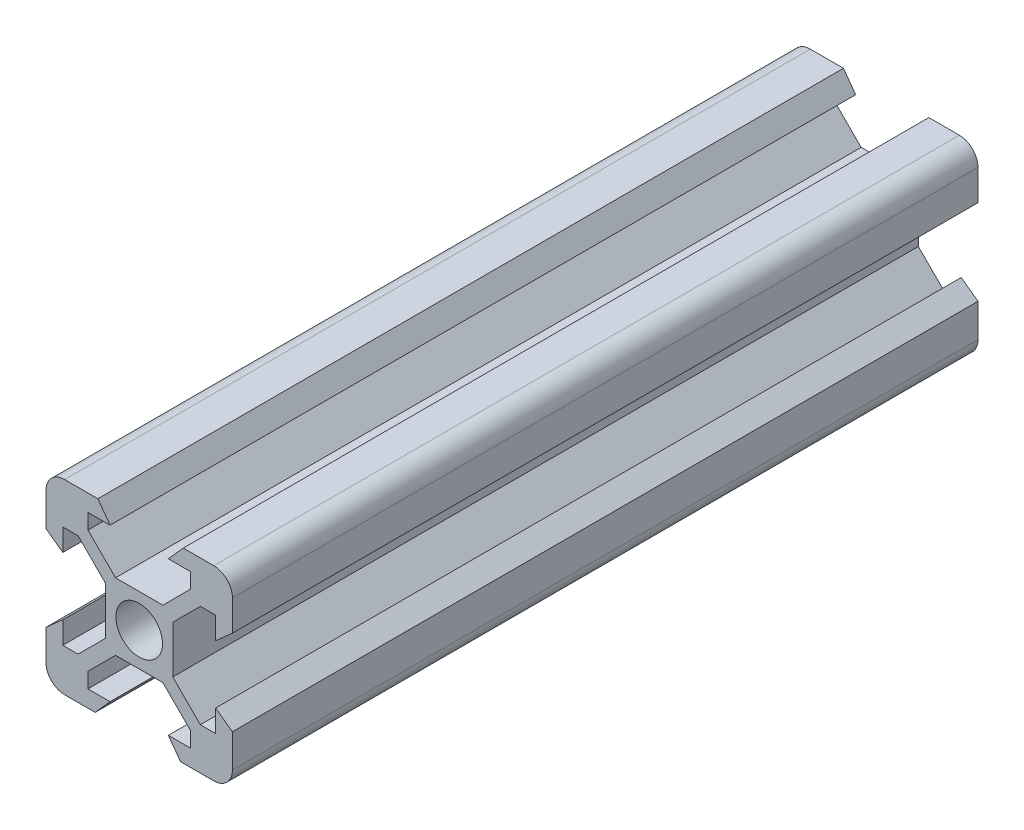
from build123d import *

# Parameters (mm, degrees)
SKETCH1_R           = 2.5
BOSS_EXTRUDE1_DEPTH = 80


with BuildPart() as part:
    # Sketch1 → Boss-Extrude1 (new body)
    with BuildSketch(Plane.XY):
        with BuildLine():
            Line((-4.725542729, -10), (-3.125, -8.2))
            Line((-3.125, -8.2), (-5.5, -8.2))
            Line((-5.5, -8.2), (-5.5, -6.560660172))
            Line((-5.5, -6.560660172), (-2.539339828, -3.6))
            Line((-2.539339828, -3.6), (2.539339828, -3.6))
            Line((2.539339828, -3.6), (5.5, -6.560660172))
            Line((5.5, -6.560660172), (5.5, -8.2))
            Line((5.5, -8.2), (3.125, -8.2))
            Line((3.125, -8.2), (4.434457271, -10))
            Line((4.434457271, -10), (8, -10))
            ThreePointArc((8, -10), (9.414213562, -9.414213562), (10, -8))
            Line((10, -8), (10, -4.434457271))
            Line((10, -4.434457271), (8.2, -3.125))
            Line((8.2, -3.125), (8.2, -5.5))
            Line((8.2, -5.5), (6.560660172, -5.5))
            Line((6.560660172, -5.5), (3.6, -2.539339828))
            Line((3.6, -2.539339828), (3.6, 2.539339828))
            Line((3.6, 2.539339828), (6.560660172, 5.5))
            Line((6.560660172, 5.5), (8.2, 5.5))
            Line((8.2, 5.5), (8.2, 3.125))
            Line((8.2, 3.125), (10, 4.725542729))
            Line((10, 4.725542729), (10, 8))
            ThreePointArc((10, 8), (9.414213562, 9.414213562), (8, 10))
            Line((8, 10), (4.725542729, 10))
            Line((4.725542729, 10), (3.125, 8.2))
            Line((3.125, 8.2), (5.5, 8.2))
            Line((5.5, 8.2), (5.5, 6.560660172))
            Line((5.5, 6.560660172), (2.539339828, 3.6))
            Line((2.539339828, 3.6), (-2.539339828, 3.6))
            Line((-2.539339828, 3.6), (-5.5, 6.560660172))
            Line((-5.5, 6.560660172), (-5.5, 8.2))
            Line((-5.5, 8.2), (-3.125, 8.2))
            Line((-3.125, 8.2), (-4.434457271, 10))
            Line((-4.434457271, 10), (-8, 10))
            ThreePointArc((-8, 10), (-9.414213562, 9.414213562), (-10, 8))
            Line((-10, 8), (-10, 4.434457271))
            Line((-10, 4.434457271), (-8.2, 3.125))
            Line((-8.2, 3.125), (-8.2, 5.5))
            Line((-8.2, 5.5), (-6.560660172, 5.5))
            Line((-6.560660172, 5.5), (-3.6, 2.539339828))
            Line((-3.6, 2.539339828), (-3.6, -2.539339828))
            Line((-3.6, -2.539339828), (-6.560660172, -5.5))
            Line((-6.560660172, -5.5), (-8.2, -5.5))
            Line((-8.2, -5.5), (-8.2, -3.125))
            Line((-8.2, -3.125), (-10, -4.725542729))
            Line((-10, -4.725542729), (-10, -8))
            ThreePointArc((-10, -8), (-9.414213562, -9.414213562), (-8, -10))
            Line((-8, -10), (-4.725542729, -10))
        make_face()
        Circle(SKETCH1_R, mode=Mode.SUBTRACT)
    extrude(amount=BOSS_EXTRUDE1_DEPTH)


solid = part.part
